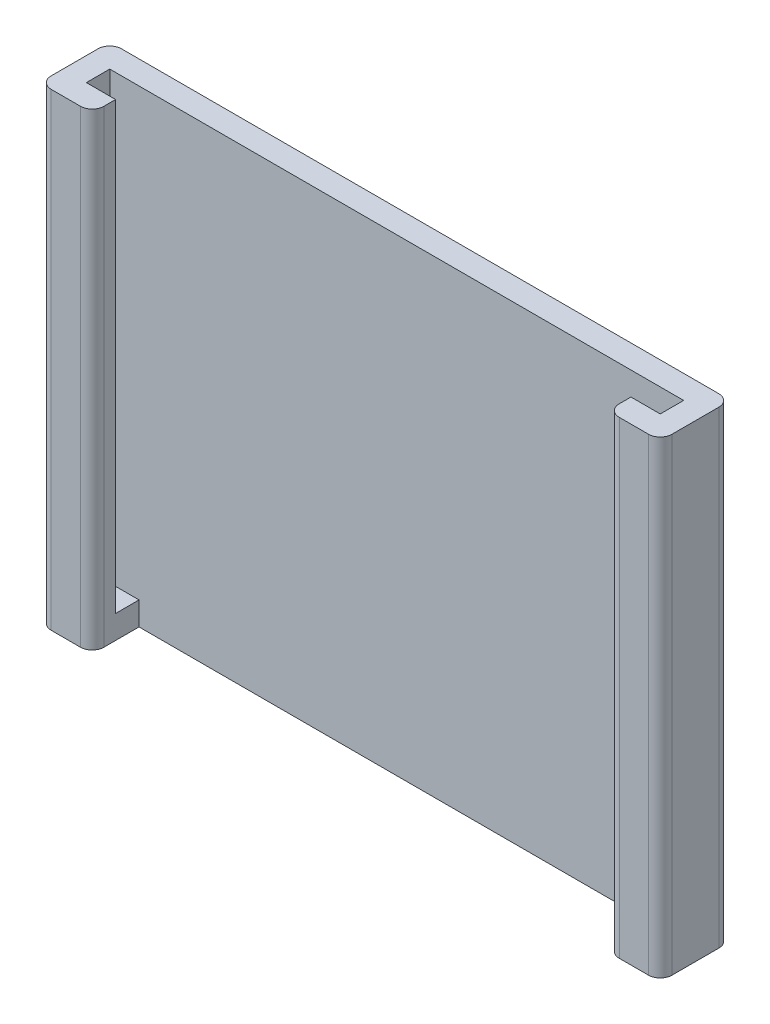
from build123d import *

# Parameters (mm, degrees)
BOSS_EXTRUDE1_DEPTH = 40
SKETCH2_W           = 2.5
SKETCH2_H           = 2
BOSS_EXTRUDE2_DEPTH = 2
FILLET1_R           = 1


with BuildPart() as part:
    # Sketch1 → Boss-Extrude1 (new body)
    with BuildSketch(Plane(origin=(0, 0, 0), x_dir=(1, 0, 0), z_dir=(0, 1, 0))):
        Polygon((26.5, 2), (-26.5, 2), (-26.5, -4), (-22, -4), (-22, -2), (-24.5, -2), (-24.5, 0), (24.5, 0), (24.5, -2), (22, -2), (22, -4), (26.5, -4), align=None)
    extrude(amount=BOSS_EXTRUDE1_DEPTH)

    # Sketch2 → Boss-Extrude2 (add)
    with BuildSketch(Plane(origin=(0, 0, 0), x_dir=(1, 0, 0), z_dir=(0, 1, 0))):
        with Locations((-23.25, -1)):
            Rectangle(SKETCH2_W, SKETCH2_H)
        with Locations((23.25, -1)):
            Rectangle(SKETCH2_W, SKETCH2_H)
    extrude(amount=BOSS_EXTRUDE2_DEPTH)

    # Fillet1
    fillet1_edges = [part.edges().sort_by_distance(p)[0] for p in [
        (22, 20, 4),
        (26.5, 20, 4),
        (26.5, 20, -2),
        (-26.5, 20, -2),
        (-26.5, 20, 4),
        (-22, 20, 4),
    ]]
    fillet(fillet1_edges, radius=FILLET1_R)


solid = part.part
